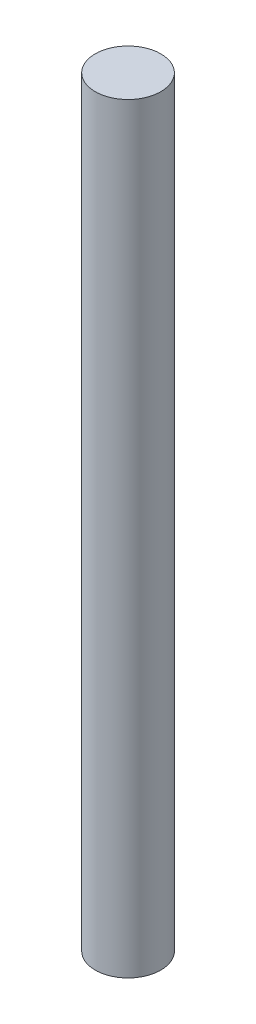
from build123d import *

# Parameters (mm, degrees)
SKETCH1_R           = 2.5
BOSS_EXTRUDE1_DEPTH = 58


with BuildPart() as part:
    # Sketch1 → Boss-Extrude1 (new body)
    with BuildSketch(Plane(origin=(0, 0, 0), x_dir=(1, 0, 0), z_dir=(0, 1, 0))):
        with Locations(Location((0, 0, 0), (0, 0, 90))):
            Circle(SKETCH1_R)
    extrude(amount=BOSS_EXTRUDE1_DEPTH)


solid = part.part
